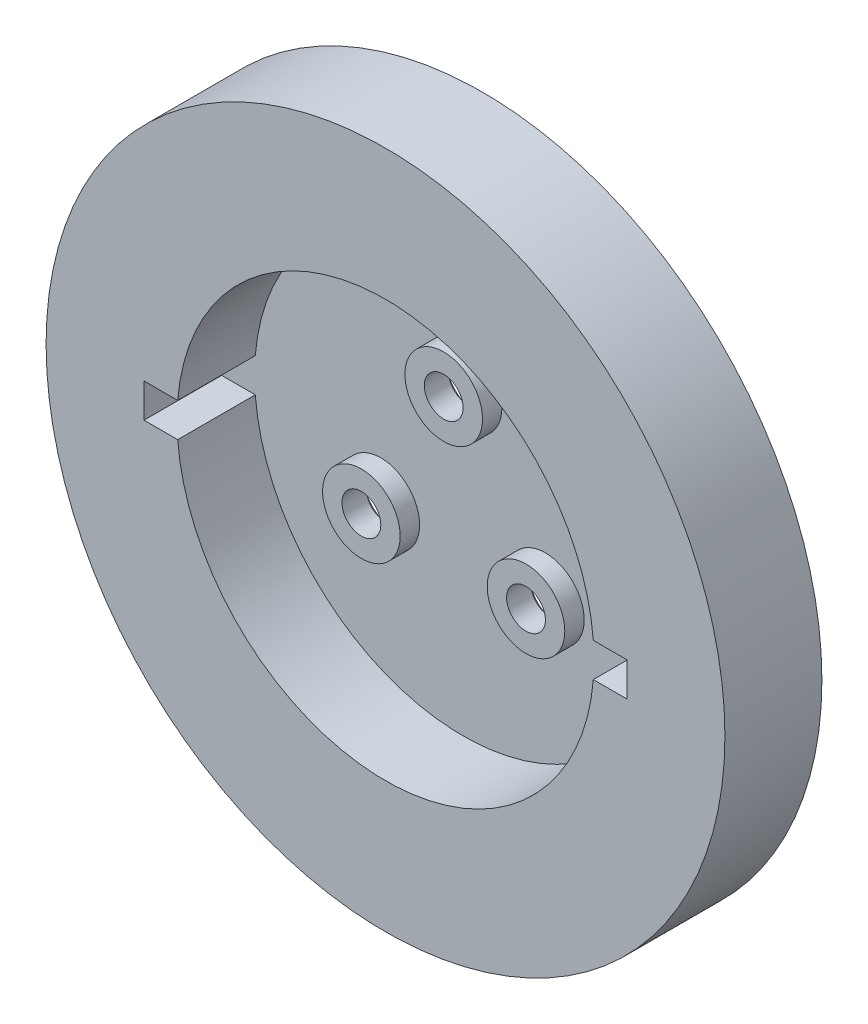
from build123d import *

# Parameters (mm, degrees)
SKETCH_1_R          = 35
EXTRUDE_1_DEPTH     = 10
CUT_EXTRUDE_1_DEPTH = 8
SKETCH_4_R          = 4
CUT_EXTRUDE_2_DEPTH = 1.5
SKETCH_6_R          = 2
CUT_EXTRUDE_3_DEPTH = 51.222007128
SKETCH_7_R          = 4
SKETCH_7_R_2        = 2
EXTRUDE_2_DEPTH     = 2
SKETCH_8_R          = 4
SKETCH_8_R_2        = 2
EXTRUDE_3_DEPTH     = 2
SKETCH_9_R          = 4
SKETCH_9_R_2        = 2
EXTRUDE_4_DEPTH     = 2


with BuildPart() as part:
    # 草图1 → 凸台-拉伸1 (new body)
    with BuildSketch(Plane.XY):
        Circle(SKETCH_1_R)
    extrude(amount=EXTRUDE_1_DEPTH)

    # 草图2 → 切除-拉伸1 (cut)
    with BuildSketch(Plane.XY.offset(10)):
        with BuildLine():
            ThreePointArc((21.428660714, 1.75), (0, 21.5), (-21.428660714, 1.75))
            Line((-21.428660714, 1.75), (-24.9, 1.75))
            Line((-24.9, 1.75), (-24.9, -1.75))
            Line((-24.9, -1.75), (-21.428660714, -1.75))
            ThreePointArc((-21.428660714, -1.75), (0, -21.5), (21.428660714, -1.75))
            Line((21.428660714, -1.75), (24.9, -1.75))
            Line((24.9, -1.75), (24.9, 1.75))
            Line((24.9, 1.75), (21.428660714, 1.75))
        make_face()
    extrude(amount=-CUT_EXTRUDE_1_DEPTH, mode=Mode.SUBTRACT)

    # 草图4 → 切除-拉伸2 (cut)
    with BuildSketch(Plane(origin=(0, 0, 0), x_dir=(-1, 0, 0), z_dir=(0, 0, -1))):
        with Locations((8.487048957, -4.9)):
            Circle(SKETCH_4_R)
        with Locations((-8.487048957, -4.9)):
            Circle(SKETCH_4_R)
        with Locations((0, 9.8)):
            Circle(SKETCH_4_R)
    extrude(amount=-CUT_EXTRUDE_2_DEPTH, mode=Mode.SUBTRACT)

    # 草图6 → 切除-拉伸3 (cut, through all)
    with BuildSketch(Plane(origin=(0, 0, 1.5), x_dir=(-1, 0, 0), z_dir=(0, 0, -1))):
        with Locations((0, 9.8)):
            Circle(SKETCH_6_R)
        with Locations((8.487048957, -4.9)):
            Circle(SKETCH_6_R)
        with Locations((-8.487048957, -4.9)):
            Circle(SKETCH_6_R)
    extrude(amount=-CUT_EXTRUDE_3_DEPTH, mode=Mode.SUBTRACT)

    # 草图7 → 凸台-拉伸2 (add)
    with BuildSketch(Plane.XY.offset(2)):
        with Locations(Location((0, 9.8, 0), (0, 0, 180))):
            Circle(SKETCH_7_R)
        with Locations(Location((0, 9.8, 0), (0, 0, 180))):
            Circle(SKETCH_7_R_2, mode=Mode.SUBTRACT)
    extrude(amount=EXTRUDE_2_DEPTH)

    # 草图8 → 凸台-拉伸3 (add)
    with BuildSketch(Plane.XY.offset(2)):
        with Locations(Location((-8.487048957, -4.9, 0), (0, 0, 180))):
            Circle(SKETCH_8_R)
        with Locations(Location((-8.487048957, -4.9, 0), (0, 0, 180))):
            Circle(SKETCH_8_R_2, mode=Mode.SUBTRACT)
    extrude(amount=EXTRUDE_3_DEPTH)

    # 草图9 → 凸台-拉伸4 (add)
    with BuildSketch(Plane.XY.offset(2)):
        with Locations(Location((8.487048957, -4.9, 0), (0, 0, 180))):
            Circle(SKETCH_9_R)
        with Locations(Location((8.487048957, -4.9, 0), (0, 0, 180))):
            Circle(SKETCH_9_R_2, mode=Mode.SUBTRACT)
    extrude(amount=EXTRUDE_4_DEPTH)


solid = part.part
